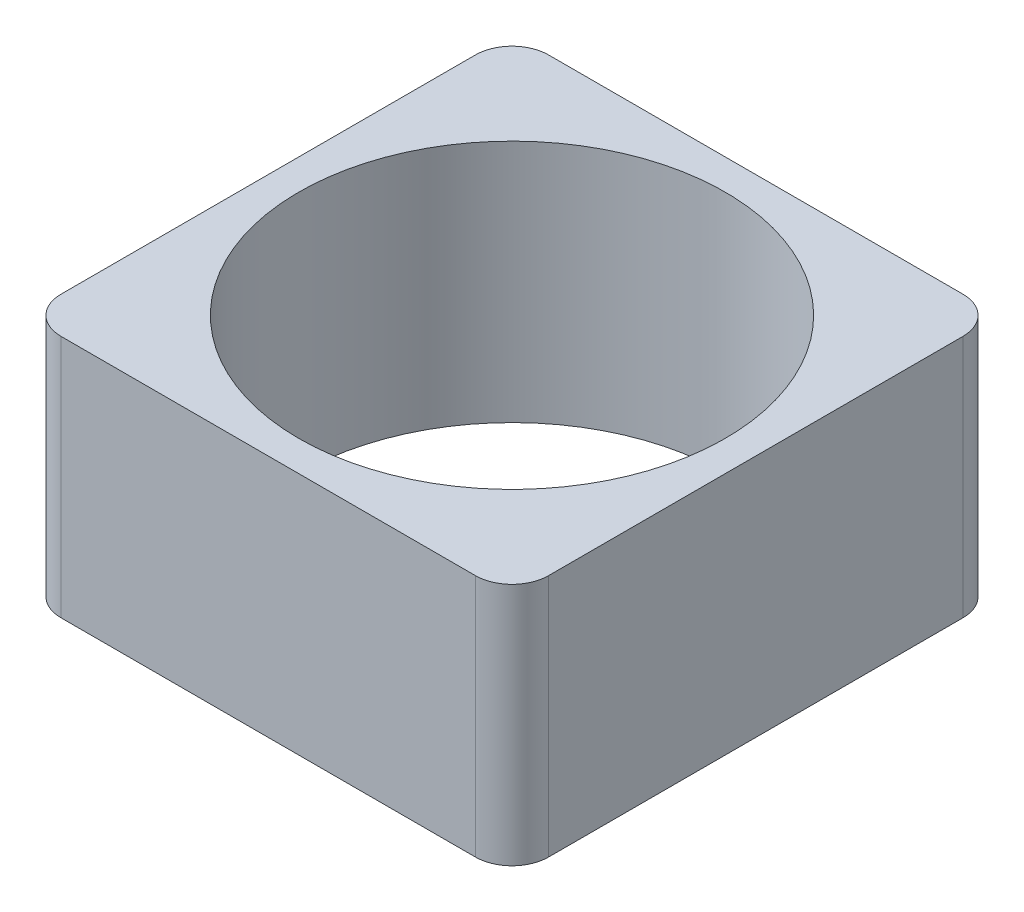
from build123d import *

# Parameters (mm, degrees)
SKETCH1_W           = 40
SKETCH1_H           = 40
BOSS_EXTRUDE1_DEPTH = 20
FILLET1_R           = 3
SKETCH2_R           = 17.5
CUT_EXTRUDE1_DEPTH  = 35.641016151


with BuildPart() as part:
    # Sketch1 → Boss-Extrude1 (new body)
    with BuildSketch(Plane(origin=(0, 0, 0), x_dir=(1, 0, 0), z_dir=(0, 1, 0))):
        Rectangle(SKETCH1_W, SKETCH1_H)
    extrude(amount=BOSS_EXTRUDE1_DEPTH)

    # Fillet1
    fillet1_edges = [part.edges().sort_by_distance(p)[0] for p in [
        (20, 10, 20),
        (-20, 10, 20),
        (-20, 10, -20),
        (20, 10, -20),
    ]]
    fillet(fillet1_edges, radius=FILLET1_R)

    # Sketch2 → Cut-Extrude1 (cut, through all)
    with BuildSketch(Plane(origin=(0, 20, 0), x_dir=(1, 0, 0), z_dir=(0, 1, 0))):
        with Locations(Location((0, 0, 0), (0, 0, 270))):
            Circle(SKETCH2_R)
    extrude(amount=-CUT_EXTRUDE1_DEPTH, mode=Mode.SUBTRACT)


solid = part.part
